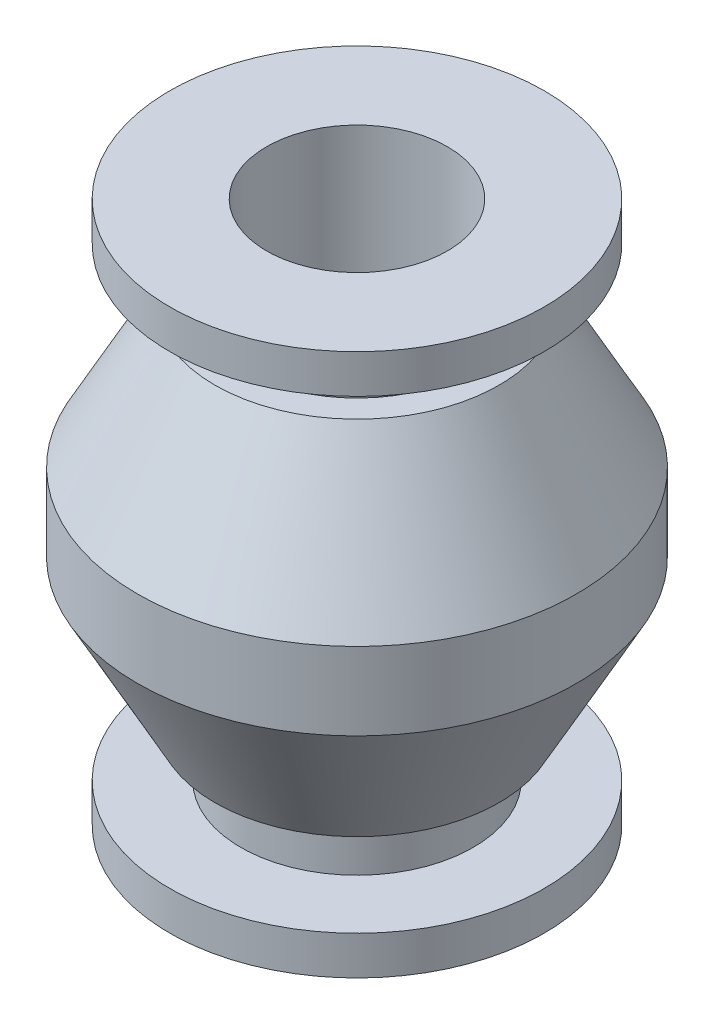
from build123d import *


with BuildPart() as part:
    # Croquis1 → Revolución2 (revolve)
    with BuildSketch(Plane.XY, mode=Mode.PRIVATE) as revoluci_n2_sk:
        Polygon((-3.5, 10.5), (-3.5, -10.5), (-7.25, -10.5), (-7.25, -9), (-4.5, -9), (-4.5, -7), (-5.5, -7), (-8.5, -1.5), (-8.5, 1.5), (-5.5, 7), (-4.5, 7), (-4.5, 9), (-7.25, 9), (-7.25, 10.5), align=None)
    revolve(revoluci_n2_sk.sketch.rotate(Axis((0, 0, 0), (0, 1, 0)), 270), axis=Axis((0, 0, 0), (0, 1, 0)))


solid = part.part
